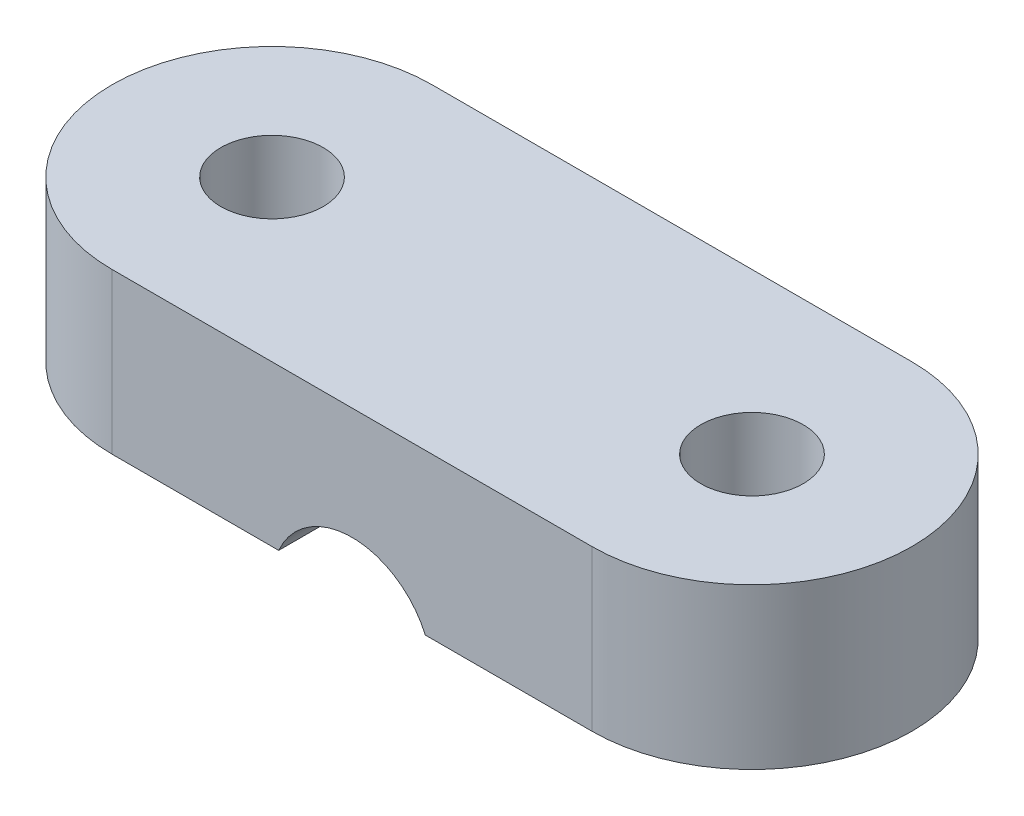
from build123d import *

# Parameters (mm, degrees)
SKETCH1_R           = 1.6
BOSS_EXTRUDE1_DEPTH = 5
SKETCH2_R           = 2.5
CUT_EXTRUDE1_DEPTH  = 17.770509831


with BuildPart() as part:
    # Sketch1 → Boss-Extrude1 (new body)
    with BuildSketch(Plane(origin=(0, 0, 0), x_dir=(1, 0, 0), z_dir=(0, 1, 0))):
        with BuildLine():
            Line((-7.5, 5), (7.5, 5))
            ThreePointArc((7.5, 5), (12.5, 0), (7.5, -5))
            Line((7.5, -5), (-7.5, -5))
            ThreePointArc((-7.5, -5), (-12.5, 0), (-7.5, 5))
        make_face()
        with Locations(Location((-7.5, 0, 0), (0, 0, 270))):
            Circle(SKETCH1_R, mode=Mode.SUBTRACT)
        with Locations(Location((7.5, 0, 0), (0, 0, 270))):
            Circle(SKETCH1_R, mode=Mode.SUBTRACT)
    extrude(amount=BOSS_EXTRUDE1_DEPTH)

    # Sketch2 → Cut-Extrude1 (cut, through all)
    with BuildSketch(Plane.XY.offset(5)):
        with Locations((0, -1)):
            Circle(SKETCH2_R)
    extrude(amount=-CUT_EXTRUDE1_DEPTH, mode=Mode.SUBTRACT)


solid = part.part
